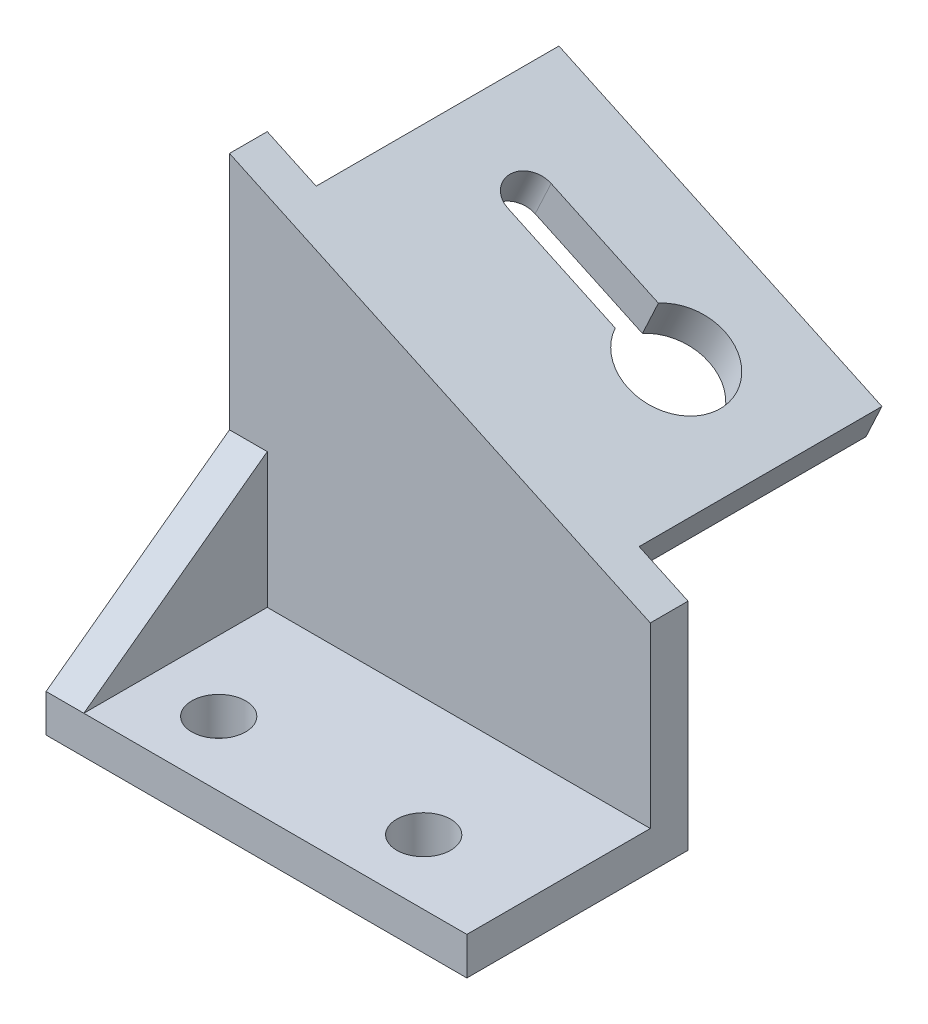
from build123d import *

# Parameters (mm, degrees)
SKETCH1_W           = 78
SKETCH1_H           = 41
SKETCH1_R           = 5
BOSS_EXTRUDE1_DEPTH = 7
BOSS_EXTRUDE3_START = -41
BOSS_EXTRUDE3_DEPTH = 7
BOSS_EXTRUDE6_DEPTH = 7
SKETCH10_W          = 66.063477679
SKETCH10_H          = 45
BOSS_EXTRUDE7_DEPTH = 7


with BuildPart() as part:
    # Sketch1 → Boss-Extrude1 (new body)
    with BuildSketch(Plane(origin=(0, 0, 0), x_dir=(1, 0, 0), z_dir=(0, 1, 0))):
        with Locations((39, 20.5)):
            Rectangle(SKETCH1_W, SKETCH1_H)
        with Locations(Location((20, 12, 0), (0, 0, 270))):
            Circle(SKETCH1_R, mode=Mode.SUBTRACT)
        with Locations(Location((58, 12, 0), (0, 0, 270))):
            Circle(SKETCH1_R, mode=Mode.SUBTRACT)
    extrude(amount=BOSS_EXTRUDE1_DEPTH)

    # Sketch5 → Boss-Extrude3 (add)
    with BuildSketch(Plane.XY.offset(BOSS_EXTRUDE3_START)):
        Polygon((0, 7), (0, 76.371997336), (78, 40), (78, 7), align=None)
    extrude(amount=BOSS_EXTRUDE3_DEPTH)

    # Sketch6 → Boss-Extrude6 (add)
    with BuildSketch(Plane(origin=(0, 0, 0), x_dir=(0, 0, -1), z_dir=(1, 0, 0))):
        Polygon((34, 7), (34, 32), (0, 7), align=None)
    extrude(amount=BOSS_EXTRUDE6_DEPTH)

    # Sketch10 → Boss-Extrude7 (add)
    with BuildSketch(Plane(origin=(29.252172085, 62.731485475, 0), x_dir=(0.9063077870366529, -0.4226182617406933, 0), z_dir=(0.4226182617406933, 0.9063077870366529, 0))):
        with Locations((10.755538079, 63.5)):
            Rectangle(SKETCH10_W, SKETCH10_H)
        with BuildLine():
            Line((-6.212723081, 70), (15.725019171, 70))
            ThreePointArc((15.725019171, 70), (32.787276919, 66), (15.725019171, 62))
            Line((15.725019171, 62), (-6.212723081, 62))
            ThreePointArc((-6.212723081, 62), (-10.212723081, 66), (-6.212723081, 70))
        make_face(mode=Mode.SUBTRACT)
    extrude(amount=-BOSS_EXTRUDE7_DEPTH)


solid = part.part
